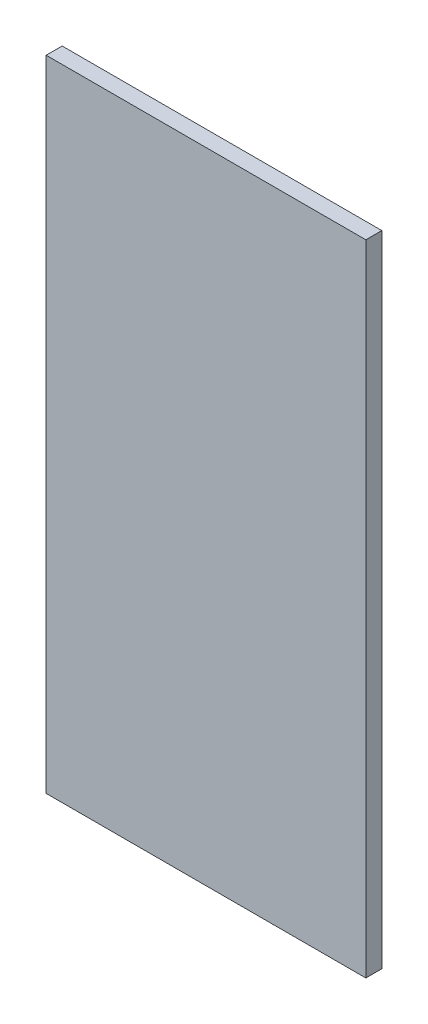
from build123d import *

# Parameters (mm, degrees)
ESQUISSE1_W        = 600
ESQUISSE1_H        = 1200
BOSS_EXTRU_1_DEPTH = 30


with BuildPart() as part:
    # Esquisse1 → Boss.-Extru.1 (new body)
    with BuildSketch(Plane.XY):
        with Locations((300, 600)):
            Rectangle(ESQUISSE1_W, ESQUISSE1_H)
    extrude(amount=BOSS_EXTRU_1_DEPTH)


solid = part.part
